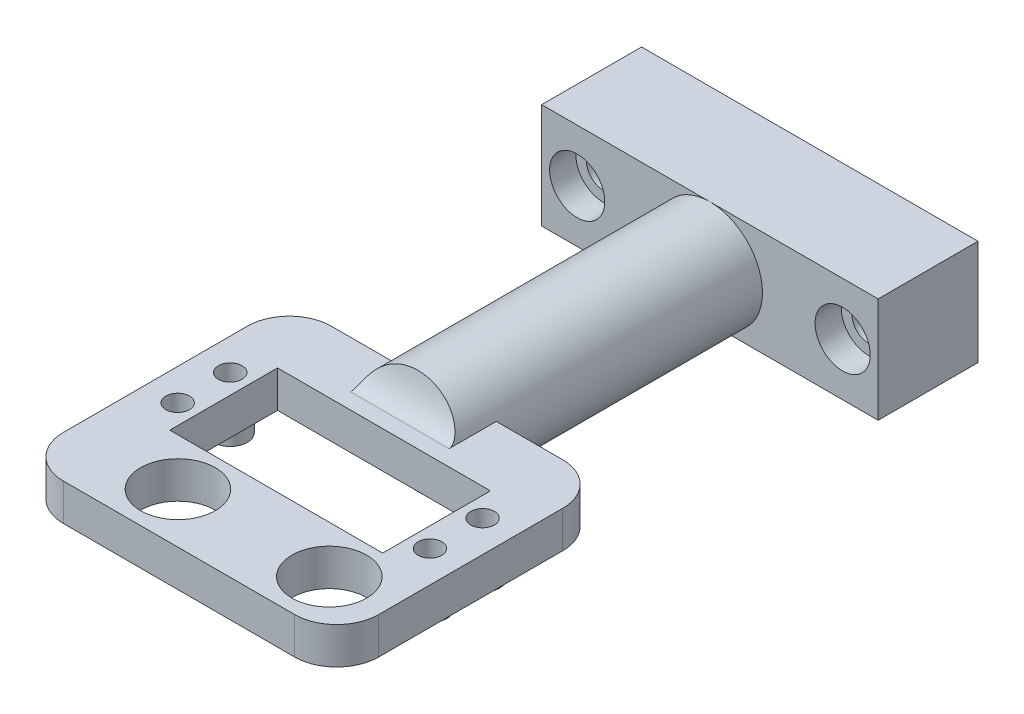
from build123d import *
from build123d.topology import SkipClean

# Parameters (mm, degrees)
SKETCH1_W           = 60
SKETCH1_H           = 42
SKETCH1_R           = 7.1
SKETCH1_R_2         = 2.25
SKETCH1_W_2         = 40.5
SKETCH1_H_2         = 20.5
BOSS_EXTRUDE1_DEPTH = 7
BOSS_EXTRUDE2_START = 2.9
SKETCH2_R           = 3.25
SKETCH2_R_2         = 2.25
BOSS_EXTRUDE2_DEPTH = 2.9
SKETCH3_R           = 10
SKETCH3_W           = 60
SKETCH3_H           = 7
BOSS_EXTRUDE3_DEPTH = 9
SKETCH4_RX          = 13.02
SKETCH4_RY          = 4
CUT_EXTRUDE1_DEPTH  = 69.426968368
FILLET1_R           = 8
BOSS_EXTRUDE4_DEPTH = 50
SKETCH6_W           = 64
SKETCH6_H           = 20
SKETCH6_R           = 3.25
BOSS_EXTRUDE5_DEPTH = 19
SKETCH7_R           = 5.25
SKETCH7_R_2         = 3.25
CUT_EXTRUDE2_DEPTH  = 5


with BuildPart() as part:
    # Sketch1 → Boss-Extrude1 (new body)
    with BuildSketch(Plane(origin=(0, 0, 0), x_dir=(1, 0, 0), z_dir=(0, 1, 0))):
        Rectangle(SKETCH1_W, SKETCH1_H)
        with Locations(Location((-9.75, -11.45, 0), (0, 0, 270))):
            Circle(SKETCH1_R, mode=Mode.SUBTRACT)
        with Locations(Location((19.05, -11.45, 0), (0, 0, 270))):
            Circle(SKETCH1_R, mode=Mode.SUBTRACT)
        with Locations(Location((24, 12.75, 0), (0, 0, 270))):
            Circle(SKETCH1_R_2, mode=Mode.SUBTRACT)
        with Locations(Location((24, 2.75, 0), (0, 0, 270))):
            Circle(SKETCH1_R_2, mode=Mode.SUBTRACT)
        with Locations(Location((-24, 2.75, 0), (0, 0, 90))):
            Circle(SKETCH1_R_2, mode=Mode.SUBTRACT)
        with Locations(Location((-24, 12.75, 0), (0, 0, 90))):
            Circle(SKETCH1_R_2, mode=Mode.SUBTRACT)
        with Locations((0, 7.75)):
            Rectangle(SKETCH1_W_2, SKETCH1_H_2, mode=Mode.SUBTRACT)
    extrude(amount=BOSS_EXTRUDE1_DEPTH)

    # Sketch2 → Boss-Extrude2 (add)
    # profile 1 of 4: a face of its own
    with SkipClean():  # the faces are left unmerged after this step: merging them gives an invalid solid
        with BuildSketch(Plane.XZ.offset(BOSS_EXTRUDE2_START)):
            with Locations(Location((24, -2.75, 0), (0, 0, 270))):
                Circle(SKETCH2_R)
            with Locations(Location((24, -2.75, 0), (0, 0, 270))):
                Circle(SKETCH2_R_2, mode=Mode.SUBTRACT)
        # profile 2 of 4: a face of its own
        with BuildSketch(Plane.XZ.offset(BOSS_EXTRUDE2_START)):
            with Locations(Location((24, -12.75, 0), (0, 0, 270))):
                Circle(SKETCH2_R)
            with Locations(Location((24, -12.75, 0), (0, 0, 270))):
                Circle(SKETCH2_R_2, mode=Mode.SUBTRACT)
        # profile 3 of 4: a face of its own
        with BuildSketch(Plane.XZ.offset(BOSS_EXTRUDE2_START)):
            with Locations(Location((-24, -12.75, 0), (0, 0, 90))):
                Circle(SKETCH2_R)
            with Locations(Location((-24, -12.75, 0), (0, 0, 270))):
                Circle(SKETCH2_R_2, mode=Mode.SUBTRACT)
        # profile 4 of 4: a face of its own
        with BuildSketch(Plane.XZ.offset(BOSS_EXTRUDE2_START)):
            with Locations(Location((-24, -2.75, 0), (0, 0, 90))):
                Circle(SKETCH2_R)
            with Locations(Location((-24, -2.75, 0), (0, 0, 270))):
                Circle(SKETCH2_R_2, mode=Mode.SUBTRACT)
        extrude(amount=-BOSS_EXTRUDE2_DEPTH)

    # Sketch3 → Boss-Extrude3 (add)
    with SkipClean():  # the faces are left unmerged after this step: merging them gives an invalid solid
        with BuildSketch(Plane(origin=(0, 0, -21), x_dir=(-1, 0, 0), z_dir=(0, 0, -1))):
            with Locations((0, 3.5)):
                Circle(SKETCH3_R)
            with Locations((0, 3.5)):
                Rectangle(SKETCH3_W, SKETCH3_H)
        extrude(amount=BOSS_EXTRUDE3_DEPTH)

    # Sketch4 → Cut-Extrude1 (cut, through all)
    with SkipClean():  # the faces are left unmerged after this step: merging them gives an invalid solid
        with BuildSketch(Plane.ZY.offset(30)):
            with Locations(Location((-21, 20.02), (0, 0, -90))):
                Ellipse(SKETCH4_RX, SKETCH4_RY)
            with Locations(Location((-21, -13.02), (0, 0, 90))):
                Ellipse(SKETCH4_RX, SKETCH4_RY)
        extrude(amount=-CUT_EXTRUDE1_DEPTH, mode=Mode.SUBTRACT)

    # Fillet1
    fillet1_edges = [part.edges().sort_by_distance(p)[0] for p in [
        (30, 3.5, 21),
        (-30, 3.5, 21),
        (30, 3.5, -30),
        (-30, 3.5, -30),
    ]]
    fillet(fillet1_edges, radius=FILLET1_R)

    # Sketch5 → Boss-Extrude4 (add)
    with SkipClean():  # the faces are left unmerged after this step: merging them gives an invalid solid
        with BuildSketch(Plane(origin=(0, 0, -30), x_dir=(-1, 0, 0), z_dir=(0, 0, -1))):
            with BuildLine():
                ThreePointArc((10, 3.5), (9.840603893, 5.278346145), (9.367496998, 7))
                ThreePointArc((9.367496998, 7), (0, 13.5), (-9.367496998, 7))
                ThreePointArc((-9.367496998, 7), (-10, 3.5), (-9.367496998, 0))
                ThreePointArc((-9.367496998, 0), (0, -6.5), (9.367496998, 0))
                ThreePointArc((9.367496998, 0), (9.840603893, 1.721653855), (10, 3.5))
            make_face()
        extrude(amount=BOSS_EXTRUDE4_DEPTH)

    # Sketch6 → Boss-Extrude5 (add)
    with SkipClean():  # the faces are left unmerged after this step: merging them gives an invalid solid
        with BuildSketch(Plane(origin=(0, 0, -80), x_dir=(-1, 0, 0), z_dir=(0, 0, -1))):
            with Locations((0, 3.5)):
                Rectangle(SKETCH6_W, SKETCH6_H)
            with Locations((-25.25, 3.5)):
                Circle(SKETCH6_R, mode=Mode.SUBTRACT)
            with Locations(Location((25.25, 3.5, 0), (0, 0, 180))):
                Circle(SKETCH6_R, mode=Mode.SUBTRACT)
        extrude(amount=BOSS_EXTRUDE5_DEPTH)

    # Sketch7 → Cut-Extrude2 (cut)
    # profile 1 of 2: a face of its own
    with SkipClean():  # the faces are left unmerged after this step: merging them gives an invalid solid
        with BuildSketch(Plane.XY.offset(-80)):
            with Locations((25.25, 3.5)):
                Circle(SKETCH7_R)
            with Locations((25.25, 3.5)):
                Circle(SKETCH7_R_2, mode=Mode.SUBTRACT)
        # profile 2 of 2: a face of its own
        with BuildSketch(Plane.XY.offset(-80)):
            with Locations((-25.25, 3.5)):
                Circle(SKETCH7_R)
            with Locations((-25.25, 3.5)):
                Circle(SKETCH7_R_2, mode=Mode.SUBTRACT)
        extrude(amount=-CUT_EXTRUDE2_DEPTH, mode=Mode.SUBTRACT)


solid = part.part
